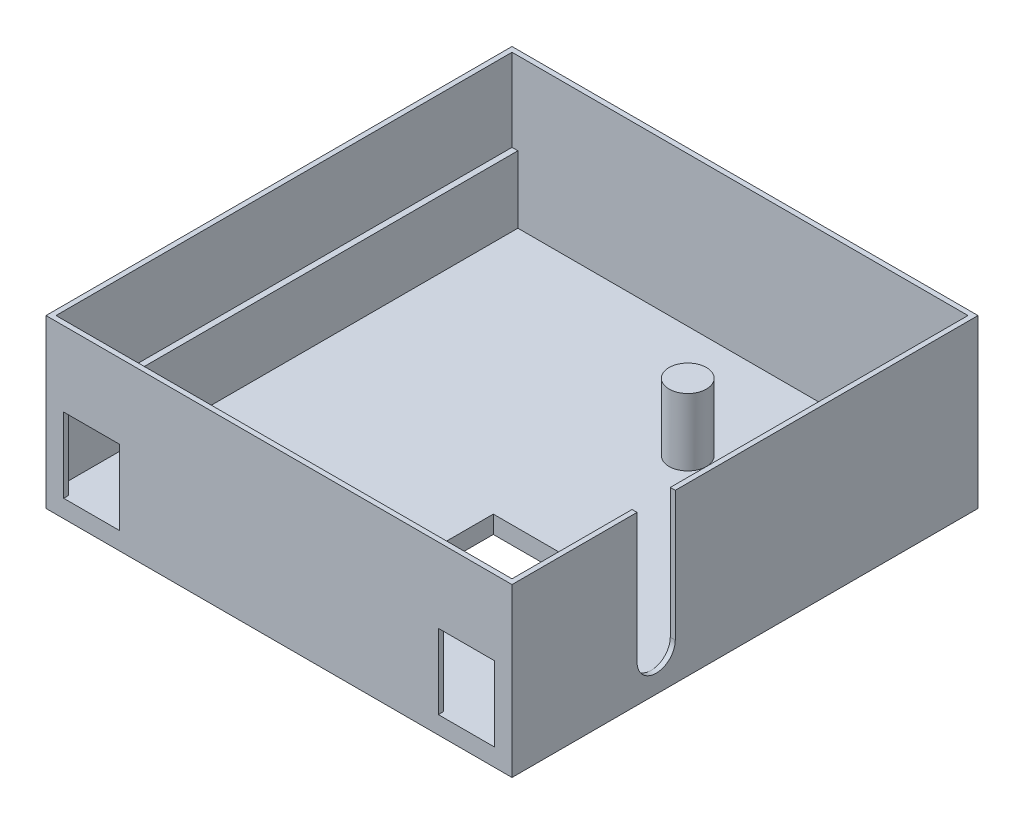
from build123d import *

# Parameters (mm, degrees)
SKETCH1_W           = 79.2
SKETCH1_H           = 79.2
BOSS_EXTRUDE1_DEPTH = 3
SKETCH2_W           = 79.2
SKETCH2_H           = 79.2
SKETCH2_W_2         = 77.5
SKETCH2_H_2         = 77.5
BOSS_EXTRUDE2_DEPTH = 25.4
SKETCH3_R           = 3.25
CUT_EXTRUDE2_DEPTH  = 0.85
SKETCH5_W           = 9.525
SKETCH5_H           = 12.7
CUT_EXTRUDE3_DEPTH  = 19.05
SKETCH6_R           = 3.175
SKETCH6_W           = 1
SKETCH6_H           = 65
BOSS_EXTRUDE3_DEPTH = 11.4
SKETCH7_W           = 12.7
SKETCH7_H           = 12.7
CUT_EXTRUDE5_DEPTH  = 26


with BuildPart() as part:
    # Sketch1 → Boss-Extrude1 (new body)
    with BuildSketch(Plane(origin=(0, 0, 0), x_dir=(1, 0, 0), z_dir=(0, 1, 0))):
        Rectangle(SKETCH1_W, SKETCH1_H)
    extrude(amount=BOSS_EXTRUDE1_DEPTH)

    # Sketch2 → Boss-Extrude2 (add)
    with BuildSketch(Plane(origin=(0, 3, 0), x_dir=(1, 0, 0), z_dir=(0, 1, 0))):
        Rectangle(SKETCH2_W, SKETCH2_H)
        Rectangle(SKETCH2_W_2, SKETCH2_H_2, mode=Mode.SUBTRACT)
    extrude(amount=BOSS_EXTRUDE2_DEPTH)

    # Sketch3 → Cut-Extrude2 (cut)
    with BuildSketch(Plane(origin=(39.6, 0, 0), x_dir=(0, 0, -1), z_dir=(1, 0, 0))):
        with Locations((-15.1, 6.35)):
            Circle(SKETCH3_R)
        with BuildLine():
            ThreePointArc((-18.35, 6.35), (-15.1, 9.6), (-11.85, 6.35))
            Line((-11.85, 6.35), (-11.85, 28.4))
            Line((-11.85, 28.4), (-18.35, 28.4))
            Line((-18.35, 28.4), (-18.35, 6.35))
        make_face()
    extrude(amount=-CUT_EXTRUDE2_DEPTH, mode=Mode.SUBTRACT)

    # Sketch5 → Cut-Extrude3 (cut)
    with BuildSketch(Plane.XY.offset(39.6)):
        with Locations((31.8375, 9.35)):
            Rectangle(SKETCH5_W, SKETCH5_H)
        with Locations((-31.8375, 9.35)):
            Rectangle(SKETCH5_W, SKETCH5_H)
    extrude(amount=-CUT_EXTRUDE3_DEPTH, mode=Mode.SUBTRACT)

    # Sketch6 → Boss-Extrude3 (add)
    with BuildSketch(Plane(origin=(0, 3, 0), x_dir=(1, 0, 0), z_dir=(0, 1, 0))):
        with Locations(Location((10.175, 19.7, 0), (0, 0, 90))):
            Circle(SKETCH6_R)
        with Locations((-38.25, 6.25)):
            Rectangle(SKETCH6_W, SKETCH6_H)
    extrude(amount=BOSS_EXTRUDE3_DEPTH)

    # Sketch7 → Cut-Extrude5 (cut)
    with BuildSketch(Plane(origin=(0, 3, 0), x_dir=(1, 0, 0), z_dir=(0, 1, 0))):
        with Locations((8.5875, -11.7625)):
            Rectangle(SKETCH7_W, SKETCH7_H)
    extrude(amount=-CUT_EXTRUDE5_DEPTH, mode=Mode.SUBTRACT)


solid = part.part
